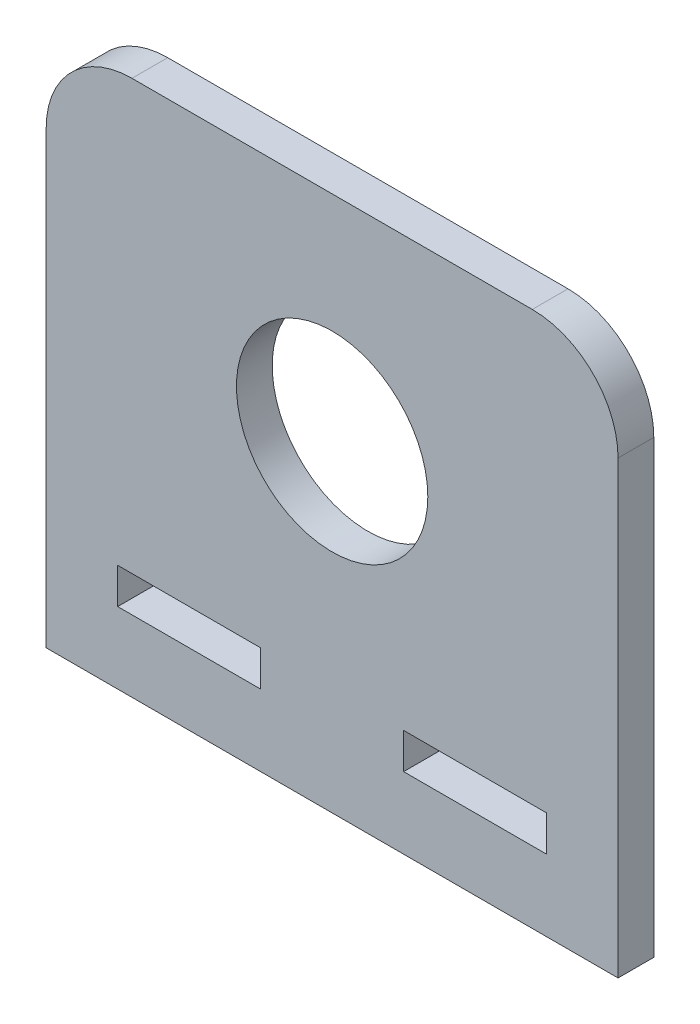
from build123d import *

# Parameters (mm, degrees)
SKETCH1_R           = 8.5
SKETCH1_W           = 12.7
SKETCH1_H           = 3.175
BOSS_EXTRUDE1_DEPTH = 3.175


with BuildPart() as part:
    # Sketch1 → Boss-Extrude1 (new body)
    with BuildSketch(Plane.XY):
        with BuildLine():
            Line((50.8, 0), (50.8, 40.005))
            ThreePointArc((50.8, 40.005), (48.568153673, 45.393153673), (43.18, 47.625))
            Line((43.18, 47.625), (7.62, 47.625))
            ThreePointArc((7.62, 47.625), (2.231846327, 45.393153673), (0, 40.005))
            Line((0, 40.005), (0, 0))
            Line((0, 0), (50.8, 0))
        make_face()
        with Locations((25.4, 28.575)):
            Circle(SKETCH1_R, mode=Mode.SUBTRACT)
        with Locations((12.7, 7.9375)):
            Rectangle(SKETCH1_W, SKETCH1_H, mode=Mode.SUBTRACT)
        with Locations((38.1, 7.9375)):
            Rectangle(SKETCH1_W, SKETCH1_H, mode=Mode.SUBTRACT)
    extrude(amount=BOSS_EXTRUDE1_DEPTH)


solid = part.part
